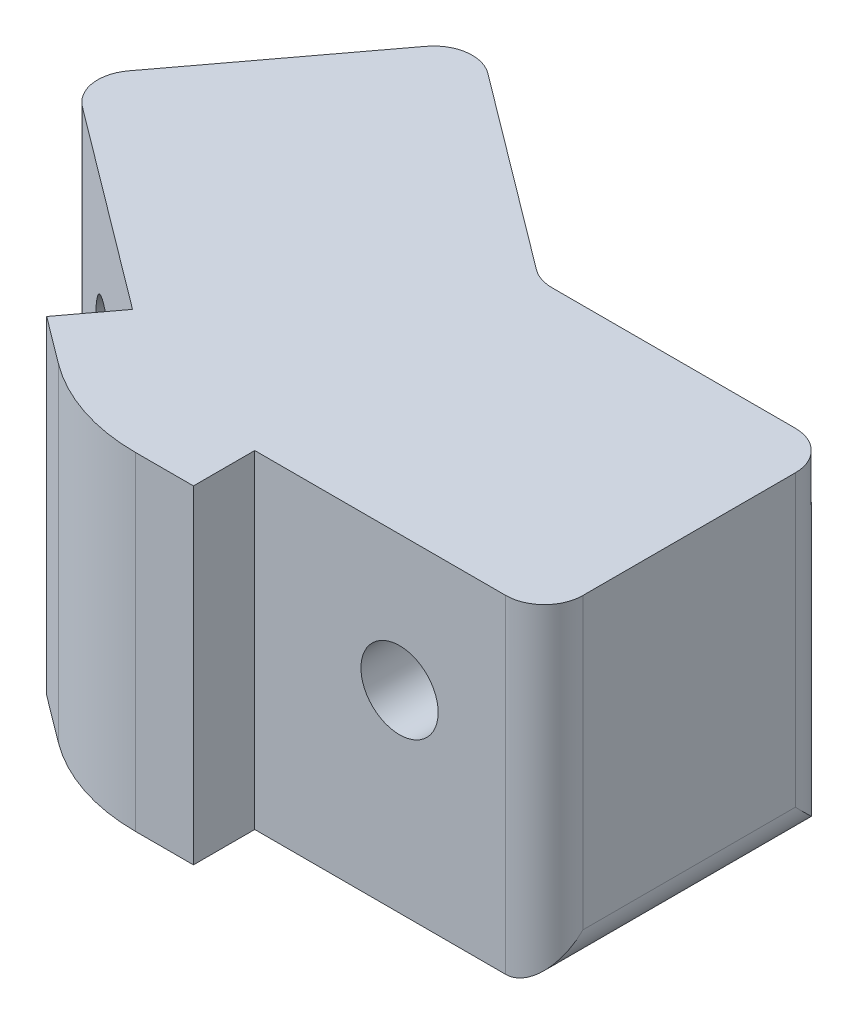
from build123d import *

# Parameters (mm, degrees)
BOSS_EXTRUDE1_DEPTH = 70
SKETCH2_R           = 2
CUT_EXTRUDE1_DEPTH  = 15
SKETCH3_R           = 2
CUT_EXTRUDE2_DEPTH  = 15
CUT_EXTRUDE3_START  = -3
CUT_EXTRUDE3_DEPTH  = 3
CUT_EXTRUDE4_START  = -3
CUT_EXTRUDE4_DEPTH  = 3
FILLET1_R           = 2
SKETCH8_W           = 45.954012469
SKETCH8_H           = 31.924176852
CUT_EXTRUDE6_DEPTH  = 53
CUT_EXTRUDE7_START  = -3
CUT_EXTRUDE7_DEPTH  = 3
CUT_EXTRUDE8_START  = -3
CUT_EXTRUDE8_DEPTH  = 3
SKETCH11_R          = 2.3876
CUT_EXTRUDE9_DEPTH  = 6.35
CUT_EXTRUDE9_DRAFT  = -8
SKETCH12_R          = 1.4951657
CUT_EXTRUDE10_DEPTH = 5
FILLET2_R           = 1


with BuildPart() as part:
    # Sketch1 → Boss-Extrude1 (new body)
    with BuildSketch(Plane(origin=(0, 0, 0), x_dir=(1, 0, 0), z_dir=(0, 1, 0))):
        with BuildLine():
            Line((-18.495, 5.34), (-9.495, 17.34))
            Line((-9.495, 17.34), (2.725, 8.175))
            Line((2.725, 8.175), (18, 8.175))
            Line((18, 8.175), (18, -6.825))
            Line((18, -6.825), (3, -6.825))
            Line((3, -6.825), (3, -10))
            Line((3, -10), (0, -10))
            ThreePointArc((0, -10), (-3.16227766, -9.486832981), (-6, -8))
            Line((-6, -8), (-8.4, -6.2))
            Line((-8.4, -6.2), (-6.495, -3.66))
            Line((-6.495, -3.66), (-18.495, 5.34))
        make_face()
    extrude(amount=BOSS_EXTRUDE1_DEPTH)

    # Sketch2 → Cut-Extrude1 (cut)
    with BuildSketch(Plane.XY.offset(6.825)):
        with Locations((10.5, 10)):
            Circle(SKETCH2_R)
        with Locations((10.5, 60)):
            Circle(SKETCH2_R)
    extrude(amount=-CUT_EXTRUDE1_DEPTH, mode=Mode.SUBTRACT)

    # Sketch3 → Cut-Extrude2 (cut)
    with BuildSketch(Plane(origin=(-4.095, 0, 5.46), x_dir=(0.8000000000000002, 0, 0.5999999999999999), z_dir=(-0.5999999999999999, 0, 0.8000000000000003))):
        with Locations((-10.5, 10)):
            Circle(SKETCH3_R)
        with Locations((-10.5, 60)):
            Circle(SKETCH3_R)
    extrude(amount=-CUT_EXTRUDE2_DEPTH, mode=Mode.SUBTRACT)

    # Sketch4 → Cut-Extrude3 (cut)
    with BuildSketch(Plane(origin=(4.905, 0, -6.54), x_dir=(-0.8000000000000002, 0, -0.5999999999999998), z_dir=(0.5999999999999998, 0, -0.8000000000000002)).offset(CUT_EXTRUDE3_START)):
        Polygon((6.28125, 12.435696448), (10.5, 14.871392896), (14.71875, 12.435696448), (14.71875, 0), (6.28125, 0), align=None)
        Polygon((10.5, 55.128607104), (14.71875, 57.564303552), (14.71875, 62.435696448), (10.5, 64.871392896), (6.28125, 62.435696448), (6.28125, 57.564303552), align=None)
    extrude(amount=-CUT_EXTRUDE3_DEPTH, mode=Mode.SUBTRACT)

    # Sketch5 → Cut-Extrude4 (cut)
    with BuildSketch(Plane(origin=(0, 0, -8.175), x_dir=(-1, 0, 0), z_dir=(0, 0, -1)).offset(CUT_EXTRUDE4_START)):
        Polygon((-14.71875, 12.435696448), (-10.5, 14.871392896), (-6.28125, 12.435696448), (-6.28125, 0), (-14.71875, 0), align=None)
        Polygon((-10.5, 55.128607104), (-6.28125, 57.564303552), (-6.28125, 62.435696448), (-10.5, 64.871392896), (-14.71875, 62.435696448), (-14.71875, 57.564303552), align=None)
    extrude(amount=-CUT_EXTRUDE4_DEPTH, mode=Mode.SUBTRACT)

    # Fillet1
    fillet1_edges = [part.edges().sort_by_distance(p)[0] for p in [
        (-13.995, 0, -11.34),
        (18, 0, -0.675),
        (-18.495, 35, -5.34),
        (-9.495, 35, -17.34),
        (2.725, 35, -8.175),
        (18, 35, -8.175),
        (18, 35, 6.825),
    ]]
    fillet(fillet1_edges, radius=FILLET1_R)

    # Sketch8 → Cut-Extrude6 (cut)
    with BuildSketch(Plane(origin=(0, 70, 0), x_dir=(1, 0, 0), z_dir=(0, 1, 0))):
        with Locations((-0.294273389, 3.101020579)):
            Rectangle(SKETCH8_W, SKETCH8_H)
    extrude(amount=-CUT_EXTRUDE6_DEPTH, mode=Mode.SUBTRACT)

    # Sketch9 → Cut-Extrude7 (cut)
    with BuildSketch(Plane(origin=(4.905, 0, -6.54), x_dir=(-0.8000000000000002, 0, -0.5999999999999998), z_dir=(0.5999999999999998, 0, -0.8000000000000002)).offset(CUT_EXTRUDE7_START)):
        with BuildLine():
            Line((12.5, 10), (12.5, 0))
            Line((12.5, 0), (8.5, 0))
            Line((8.5, 0), (8.5, 10))
            ThreePointArc((8.5, 10), (10.5, 8), (12.5, 10))
        make_face()
    extrude(amount=CUT_EXTRUDE7_DEPTH, mode=Mode.SUBTRACT)

    # Sketch10 → Cut-Extrude8 (cut)
    with BuildSketch(Plane(origin=(0, 0, -8.175), x_dir=(-1, 0, 0), z_dir=(0, 0, -1)).offset(CUT_EXTRUDE8_START)):
        with BuildLine():
            Line((-8.5, 10), (-8.5, 0))
            Line((-8.5, 0), (-12.5, 0))
            Line((-12.5, 0), (-12.5, 10))
            ThreePointArc((-12.5, 10), (-10.5, 8), (-8.5, 10))
        make_face()
    extrude(amount=CUT_EXTRUDE8_DEPTH, mode=Mode.SUBTRACT)


with BuildPart() as cut_extrude9_tool:
    # Sketch11 → Cut-Extrude9 (with draft: the straight prism first)
    with BuildSketch(Plane.XZ):
        with Locations((0.333333333, -1)):
            Circle(SKETCH11_R)
    extrude(amount=-CUT_EXTRUDE9_DEPTH)
    # Cut-Extrude9: the draft: its side faces are tilted about the plane it starts from
    cut_extrude9_sides = [cut_extrude9_tool.faces().sort_by_distance(p)[0] for p in [
        (-2.054266667, 3.175, -1),
    ]]
    draft(cut_extrude9_sides, Plane.XZ, CUT_EXTRUDE9_DRAFT)


with BuildPart() as part_1:
    add(part.part)

    # Cut-Extrude9: cut by cut_extrude9_tool
    add(cut_extrude9_tool.part, mode=Mode.SUBTRACT)

    # Sketch12 → Cut-Extrude10 (cut)
    with BuildSketch(Plane.XZ.offset(-6.35)):
        with Locations(Location((0.333333333, -1, 0), (0, 0, 270))):
            Circle(SKETCH12_R)
    extrude(amount=-CUT_EXTRUDE10_DEPTH, mode=Mode.SUBTRACT)

    # Fillet2
    fillet2_edges = [part_1.edges().sort_by_distance(p)[0] for p in [
        (-5.995, 0, -12.84),
        (-2.795, 0, -10.44),
        (8.5, 0, -6.675),
        (12.5, 0, -6.675),
    ]]
    fillet(fillet2_edges, radius=FILLET2_R)


solid = part_1.part
